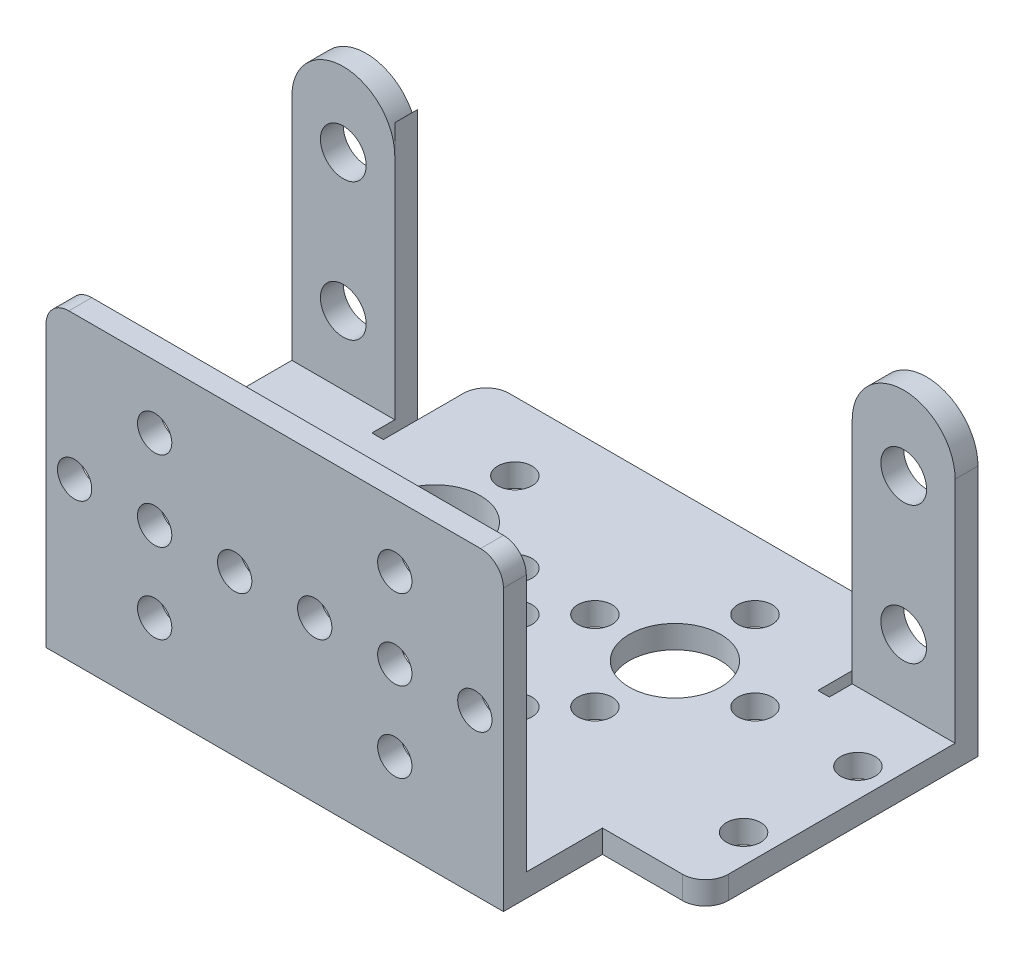
from build123d import *

# Parameters (mm, degrees)
SKETCH_1_W               = 58
SKETCH_1_H               = 37.5
EXTRUDE_1_DEPTH          = 26.5
SKETCH_3_W               = 8.53894027
SKETCH_3_H               = 24.5
SKETCH_3_W_2             = 28.5
SKETCH_3_H_2             = 25.319580512
CUT_EXTRUDE_1_DEPTH      = 67.466626964
CUT_EXTRUDE_2_DEPTH      = 43.341616644
CUT_EXTRUDE_2_DEPTH_BACK = 26
SKETCH_4_W               = 1
SKETCH_4_H               = 2
SKETCH_4_R               = 4
SKETCH_5_W               = 38
SKETCH_5_H               = 24.5
CUT_EXTRUDE_3_DEPTH      = 26
SKETCH_6_R               = 1.5
CUT_EXTRUDE_4_DEPTH      = 43.341616644
SKETCH_7_R               = 2
SKETCH_7_R_2             = 1.5
CUT_EXTRUDE_5_DEPTH      = 51.985291997


with BuildPart() as part:
    # 草图1 → 凸台-拉伸1 (new body)
    with BuildSketch(Plane(origin=(0, 0, 0), x_dir=(1, 0, 0), z_dir=(0, 1, 0))):
        Rectangle(SKETCH_1_W, SKETCH_1_H)
    extrude(amount=EXTRUDE_1_DEPTH)

    # 草图3 → 切除-拉伸1 (cut, through all)
    with BuildSketch(Plane(origin=(29, 0, 0), x_dir=(0, 0, -1), z_dir=(1, 0, 0))):
        with Locations((18.019470135, 14.25)):
            Rectangle(SKETCH_3_W, SKETCH_3_H)
        with Locations((-2.5, 14.659790256)):
            Rectangle(SKETCH_3_W_2, SKETCH_3_H_2)
    extrude(amount=-CUT_EXTRUDE_1_DEPTH, mode=Mode.SUBTRACT)

    # 草图4 → 切除-拉伸2 (cut, two sides: drawn at the far end of the back side and taken through both)
    with BuildSketch(Plane(origin=(0, 2, 0), x_dir=(1, 0, 0), z_dir=(0, 1, 0)).offset(-CUT_EXTRUDE_2_DEPTH_BACK)):
        with BuildLine():
            Line((-29, 18.75), (-29, 13.75))
            Line((-29, 13.75), (-20, 13.75))
            Line((-20, 13.75), (-20, 11.75))
            Line((-20, 11.75), (-19, 11.75))
            Line((-19, 11.75), (-19, 16.75))
            ThreePointArc((-19, 16.75), (-18.414213562, 18.164213562), (-17, 18.75))
            Line((-17, 18.75), (-29, 18.75))
        make_face()
        with BuildLine():
            Line((29, 18.75), (17, 18.75))
            ThreePointArc((17, 18.75), (18.414213562, 18.164213562), (19, 16.75))
            Line((19, 16.75), (19, 11.75))
            Line((19, 11.75), (20, 11.75))
            Line((20, 11.75), (20, 13.75))
            Line((20, 13.75), (29, 13.75))
            Line((29, 13.75), (29, 18.75))
        make_face()
        with Locations((-19.5, 10.75)):
            Rectangle(SKETCH_4_W, SKETCH_4_H)
        with Locations((19.5, 10.75)):
            Rectangle(SKETCH_4_W, SKETCH_4_H)
        with BuildLine():
            Line((20, -21.492429243), (29, -21.492429243))
            Line((29, -21.492429243), (29, -8.086828318))
            ThreePointArc((29, -8.086828318), (28.414213562, -9.50104188), (27, -10.086828318))
            Line((27, -10.086828318), (20, -10.086828318))
            Line((20, -10.086828318), (20, -21.492429243))
        make_face()
        with BuildLine():
            Line((-20, -21.492429243), (-29, -21.492429243))
            Line((-29, -21.492429243), (-29, -8.086828318))
            ThreePointArc((-29, -8.086828318), (-28.414213562, -9.50104188), (-27, -10.086828318))
            Line((-27, -10.086828318), (-20, -10.086828318))
            Line((-20, -10.086828318), (-20, -21.492429243))
        make_face()
        with Locations(Location((-10.5, 5.75, 0), (0, 0, 90))):
            Circle(SKETCH_4_R)
        with Locations(Location((0, -4.75, 0), (0, 0, 90))):
            Circle(SKETCH_4_R)
        with Locations(Location((10.5, 5.75, 0), (0, 0, 90))):
            Circle(SKETCH_4_R)
    extrude(amount=CUT_EXTRUDE_2_DEPTH + CUT_EXTRUDE_2_DEPTH_BACK, mode=Mode.SUBTRACT)

    # 草图5 → 切除-拉伸3 (cut)
    with BuildSketch(Plane(origin=(0, 0, -13.75), x_dir=(-1, 0, 0), z_dir=(0, 0, -1))):
        with Locations((0, 14.25)):
            Rectangle(SKETCH_5_W, SKETCH_5_H)
    extrude(amount=-CUT_EXTRUDE_3_DEPTH, mode=Mode.SUBTRACT)

    # 草图6 → 切除-拉伸4 (cut, through all)
    with BuildSketch(Plane(origin=(0, 2, 0), x_dir=(1, 0, 0), z_dir=(0, 1, 0))):
        with Locations(Location((-26.5, 5.75, 0), (0, 0, 270))):
            Circle(SKETCH_6_R)
        with Locations(Location((-26.5, -4.25, 0), (0, 0, 270))):
            Circle(SKETCH_6_R)
        with Locations(Location((-17.5, 5.75, 0), (0, 0, 270))):
            Circle(SKETCH_6_R)
        with Locations(Location((-10.5, 12.75, 0), (0, 0, 270))):
            Circle(SKETCH_6_R)
        with Locations(Location((10.5, 12.75, 0), (0, 0, 270))):
            Circle(SKETCH_6_R)
        with Locations(Location((-3.5, 5.75, 0), (0, 0, 270))):
            Circle(SKETCH_6_R)
        with Locations(Location((0, 2.25, 0), (0, 0, 270))):
            Circle(SKETCH_6_R)
        with Locations(Location((3.5, 5.75, 0), (0, 0, 270))):
            Circle(SKETCH_6_R)
        with Locations(Location((-10.5, -1.25, 0), (0, 0, 270))):
            Circle(SKETCH_6_R)
        with Locations(Location((-7, -4.75, 0), (0, 0, 270))):
            Circle(SKETCH_6_R)
        with Locations(Location((0, -11.75, 0), (0, 0, 270))):
            Circle(SKETCH_6_R)
        with Locations(Location((7, -4.75, 0), (0, 0, 270))):
            Circle(SKETCH_6_R)
        with Locations(Location((10.5, -1.25, 0), (0, 0, 270))):
            Circle(SKETCH_6_R)
        with Locations(Location((17.5, 5.75, 0), (0, 0, 270))):
            Circle(SKETCH_6_R)
        with Locations(Location((26.5, 5.75, 0), (0, 0, 270))):
            Circle(SKETCH_6_R)
        with Locations(Location((26.5, -4.25, 0), (0, 0, 270))):
            Circle(SKETCH_6_R)
    extrude(amount=-CUT_EXTRUDE_4_DEPTH, mode=Mode.SUBTRACT)

    # 草图7 → 切除-拉伸5 (cut, through all)
    with BuildSketch(Plane(origin=(0, 0, -13.75), x_dir=(-1, 0, 0), z_dir=(0, 0, -1))):
        with BuildLine():
            ThreePointArc((-29, 22), (-27.681980515, 25.181980515), (-24.5, 26.5))
            Line((-24.5, 26.5), (-29, 26.5))
            Line((-29, 26.5), (-29, 22))
        make_face()
        with BuildLine():
            ThreePointArc((-24.5, 26.5), (-21.318019485, 25.181980515), (-20, 22))
            Line((-20, 22), (-20, 24.5))
            Line((-20, 24.5), (-20, 26.5))
            Line((-20, 26.5), (-24.5, 26.5))
        make_face()
        with Locations((-24.502255963, 20)):
            Circle(SKETCH_7_R)
        with Locations((-24.502255963, 8)):
            Circle(SKETCH_7_R)
        with BuildLine():
            Line((-20, 26.5), (-20, 24.5))
            ThreePointArc((-20, 24.5), (-19.414213562, 25.914213562), (-18, 26.5))
            Line((-18, 26.5), (-20, 26.5))
        make_face()
        with BuildLine():
            Line((24.502255963, 26.5), (18, 26.5))
            ThreePointArc((18, 26.5), (19.414213562, 25.914213562), (20, 24.5))
            Line((20, 24.5), (20.002255963, 22))
            ThreePointArc((20.002255963, 22), (21.320275448, 25.181980515), (24.502255963, 26.5))
        make_face()
        with BuildLine():
            Line((29, 26.5), (24.502255963, 26.5))
            ThreePointArc((24.502255963, 26.5), (27.684236479, 25.181980515), (29.002255963, 22))
            Line((29.002255963, 22), (29, 26.5))
        make_face()
        with Locations((24.502255963, 20)):
            Circle(SKETCH_7_R)
        with Locations((10.5, 21)):
            Circle(SKETCH_7_R_2)
        with Locations((-10.5, 7)):
            Circle(SKETCH_7_R_2)
        with Locations((3.5, 14)):
            Circle(SKETCH_7_R_2)
        with Locations((10.5, 14)):
            Circle(SKETCH_7_R_2)
        with Locations((17.5, 14)):
            Circle(SKETCH_7_R_2)
        with Locations((24.502255963, 8)):
            Circle(SKETCH_7_R)
        with Locations((10.5, 7)):
            Circle(SKETCH_7_R_2)
        with Locations((-17.5, 14)):
            Circle(SKETCH_7_R_2)
        with Locations((-10.5, 14)):
            Circle(SKETCH_7_R_2)
        with Locations((-10.5, 21)):
            Circle(SKETCH_7_R_2)
        with Locations((-3.5, 14)):
            Circle(SKETCH_7_R_2)
    extrude(amount=-CUT_EXTRUDE_5_DEPTH, mode=Mode.SUBTRACT)


solid = part.part
